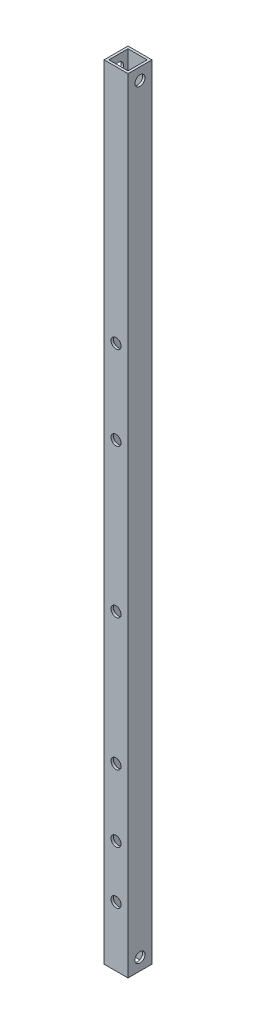
from build123d import *

# Parameters (mm, degrees)
SKETCH_1_W          = 10
SKETCH_1_H          = 10
SKETCH_1_W_2        = 8
SKETCH_1_H_2        = 8
EXTRUDE_1_DEPTH     = 327
SKETCH_2_R          = 2.1
CUT_EXTRUDE_1_DEPTH = 328.191075673
SKETCH_3_R          = 2.1
CUT_EXTRUDE_2_DEPTH = 328.191075673
SKETCH_4_R          = 2.1
CUT_EXTRUDE_3_DEPTH = 328.191075673


with BuildPart() as part:
    # ｽｹｯﾁ1 → 押し出し-薄板1 (new body)
    with BuildSketch(Plane(origin=(0, 0, 0), x_dir=(1, 0, 0), z_dir=(0, 1, 0))):
        Rectangle(SKETCH_1_W, SKETCH_1_H)
        Rectangle(SKETCH_1_W_2, SKETCH_1_H_2, mode=Mode.SUBTRACT)
    extrude(amount=EXTRUDE_1_DEPTH)

    # ｽｹｯﾁ2 → ｶｯﾄ - 押し出し1 (cut, through all)
    with BuildSketch(Plane(origin=(5, 0, 0), x_dir=(0, 0, -1), z_dir=(1, 0, 0))):
        with Locations((0, 322)):
            Circle(SKETCH_2_R)
        with Locations((0, 5)):
            Circle(SKETCH_2_R)
    extrude(amount=-CUT_EXTRUDE_1_DEPTH, mode=Mode.SUBTRACT)

    # ｽｹｯﾁ3 → ｶｯﾄ - 押し出し2 (cut, through all)
    with BuildSketch(Plane(origin=(0, 0, -5), x_dir=(-1, 0, 0), z_dir=(0, 0, -1))):
        with Locations((0, 130)):
            Circle(SKETCH_3_R)
        with Locations((0, 75)):
            Circle(SKETCH_3_R)
        with Locations((0, 47)):
            Circle(SKETCH_3_R)
        with Locations((0, 25)):
            Circle(SKETCH_3_R)
    extrude(amount=-CUT_EXTRUDE_2_DEPTH, mode=Mode.SUBTRACT)

    # ｽｹｯﾁ4 → ｶｯﾄ - 押し出し3 (cut, through all)
    with BuildSketch(Plane.XY.offset(5)):
        with Locations((0, 192)):
            Circle(SKETCH_4_R)
        with Locations((0, 227)):
            Circle(SKETCH_4_R)
    extrude(amount=-CUT_EXTRUDE_3_DEPTH, mode=Mode.SUBTRACT)


solid = part.part
